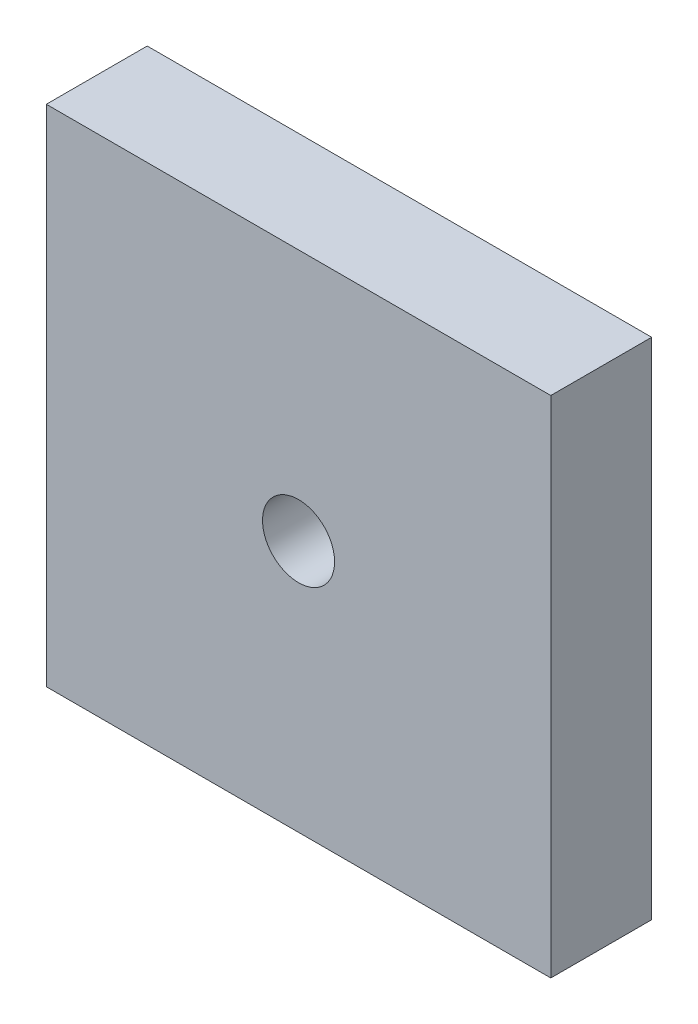
from build123d import *

# Parameters (mm, degrees)
SKETCH_1_W          = 14
SKETCH_1_H          = 14
EXTRUDE_1_DEPTH     = 2.8
SKETCH_1_3_R        = 1
CUT_EXTRUDE_1_DEPTH = 2.8


with BuildPart() as part:
    # 草图1 → 凸台-拉伸1 (new body)
    with BuildSketch(Plane.XY):
        Rectangle(SKETCH_1_W, SKETCH_1_H)
    extrude(amount=EXTRUDE_1_DEPTH)

    # 草图1<3> → 切除-拉伸1 (cut)
    with BuildSketch(Plane.XY):
        Circle(SKETCH_1_3_R)
    extrude(amount=CUT_EXTRUDE_1_DEPTH, mode=Mode.SUBTRACT)


solid = part.part
